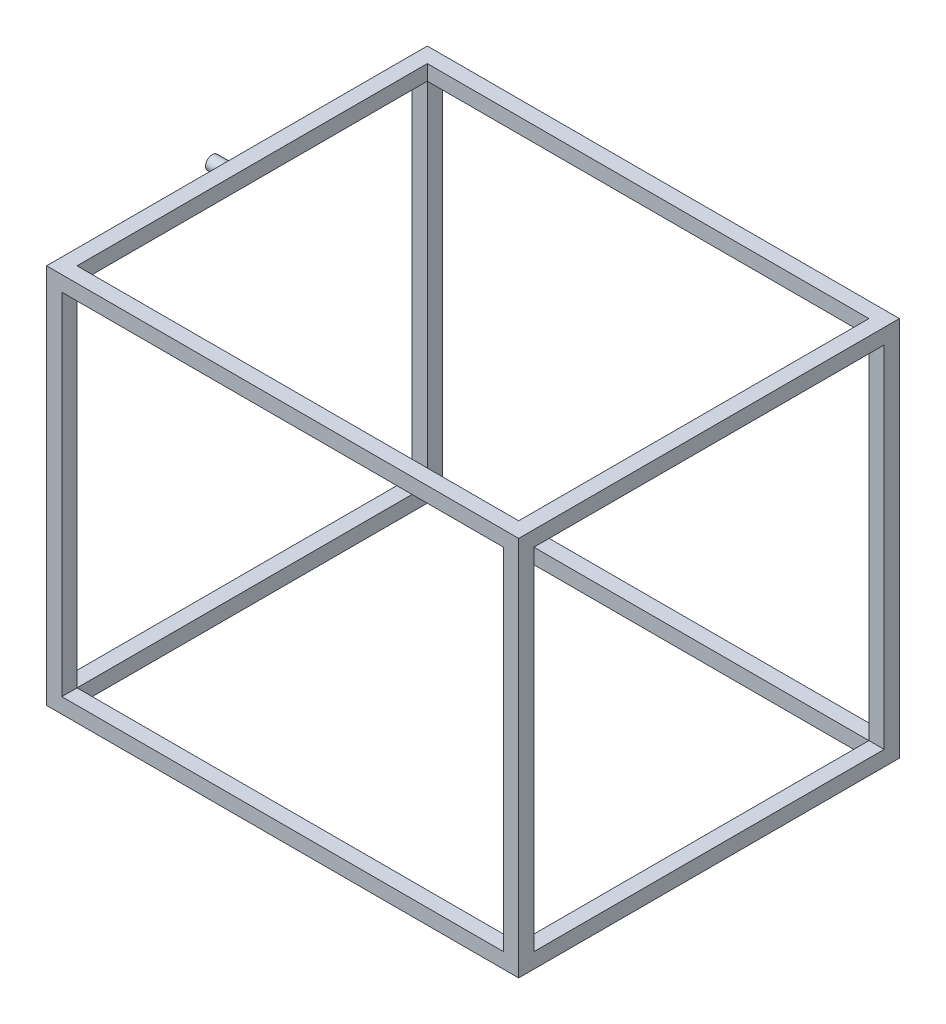
from build123d import *

# Parameters (mm, degrees)
SKETCH_1_W      = 20
SKETCH_1_H      = 20
EXTRUDE_1_DEPTH = 500
SKETCH_2_W      = 20
SKETCH_2_H      = 20
EXTRUDE_2_DEPTH = 580
SKETCH_3_W      = 500
SKETCH_3_H      = 20
EXTRUDE_3_DEPTH = 20
SKETCH_4_W      = 20
SKETCH_4_H      = 20
EXTRUDE_4_DEPTH = 460
SKETCH_5_W      = 620
SKETCH_5_H      = 500
SKETCH_5_W_2    = 580
SKETCH_5_H_2    = 460
EXTRUDE_5_DEPTH = 20
SKETCH_6_R      = 8.86405517
EXTRUDE_6_DEPTH = 20


with BuildPart() as part:
    # 草图1 → 凸台-拉伸1 (new body)
    with BuildSketch(Plane.XY):
        with Locations((10, -10)):
            Rectangle(SKETCH_1_W, SKETCH_1_H)
    extrude(amount=EXTRUDE_1_DEPTH)

    # 草图2 → 凸台-拉伸2 (add)
    with BuildSketch(Plane.ZY):
        with Locations((490, -10)):
            Rectangle(SKETCH_2_W, SKETCH_2_H)
        with Locations((10, -10)):
            Rectangle(SKETCH_2_W, SKETCH_2_H)
    extrude(amount=EXTRUDE_2_DEPTH)

    # 草图3 → 凸台-拉伸3 (add)
    with BuildSketch(Plane.ZY.offset(580)):
        with Locations((250, -10)):
            Rectangle(SKETCH_3_W, SKETCH_3_H)
    extrude(amount=EXTRUDE_3_DEPTH)

    # 草图4 → 凸台-拉伸4 (add)
    with BuildSketch(Plane(origin=(0, 0, 0), x_dir=(1, 0, 0), z_dir=(0, 1, 0))):
        with Locations((10, -10)):
            Rectangle(SKETCH_4_W, SKETCH_4_H)
        with Locations((10, -490)):
            Rectangle(SKETCH_4_W, SKETCH_4_H)
        with Locations((-590, -490)):
            Rectangle(SKETCH_4_W, SKETCH_4_H)
        with Locations((-590, -10)):
            Rectangle(SKETCH_4_W, SKETCH_4_H)
    extrude(amount=EXTRUDE_4_DEPTH)

    # 草图5 → 凸台-拉伸5 (add)
    with BuildSketch(Plane(origin=(0, 460, 0), x_dir=(1, 0, 0), z_dir=(0, 1, 0))):
        with Locations((-290, -250)):
            Rectangle(SKETCH_5_W, SKETCH_5_H)
        with Locations((-290, -250)):
            Rectangle(SKETCH_5_W_2, SKETCH_5_H_2, mode=Mode.SUBTRACT)
    extrude(amount=EXTRUDE_5_DEPTH)

    # 草图6 → 凸台-拉伸6 (add)
    with BuildSketch(Plane.ZY.offset(600)):
        with Locations(Location((262.359920907, 468.86405517, 0), (0, 0, 270))):
            Circle(SKETCH_6_R)
    extrude(amount=EXTRUDE_6_DEPTH)


solid = part.part
